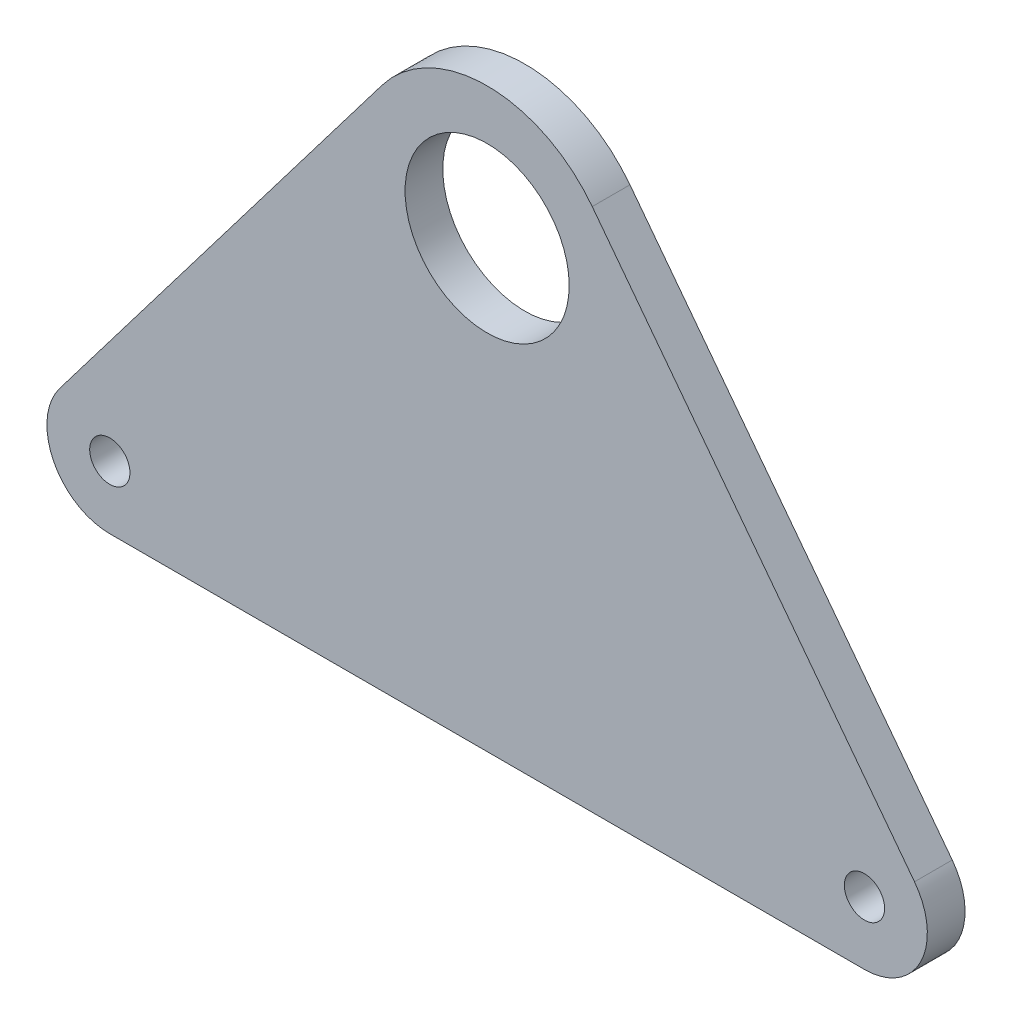
from build123d import *

# Parameters (mm, degrees)
SKETCH_1_R      = 6.525
SKETCH_1_R_2    = 1.6
EXTRUDE_1_DEPTH = 3


with BuildPart() as part:
    # ｽｹｯﾁ1 → ﾎﾞｽ - 押し出し1 (new body)
    with BuildSketch(Plane.XY):
        with BuildLine():
            Line((-8.356610944, 6.357440801), (-33.979338545, -27.322647238))
            ThreePointArc((-33.979338545, -27.322647238), (-34.479774761, -32.570724678), (-30, -35.35))
            Line((-30, -35.35), (30, -35.35))
            ThreePointArc((30, -35.35), (34.479774761, -32.570724678), (33.979338545, -27.322647238))
            Line((33.979338545, -27.322647238), (8.356610944, 6.357440801))
            ThreePointArc((8.356610944, 6.357440801), (0, 10.5), (-8.356610944, 6.357440801))
        make_face()
        Circle(SKETCH_1_R, mode=Mode.SUBTRACT)
        with Locations((-30, -30.35)):
            Circle(SKETCH_1_R_2, mode=Mode.SUBTRACT)
        with Locations(Location((30, -30.35, 0), (0, 0, 180))):
            Circle(SKETCH_1_R_2, mode=Mode.SUBTRACT)
    extrude(amount=EXTRUDE_1_DEPTH)


solid = part.part
